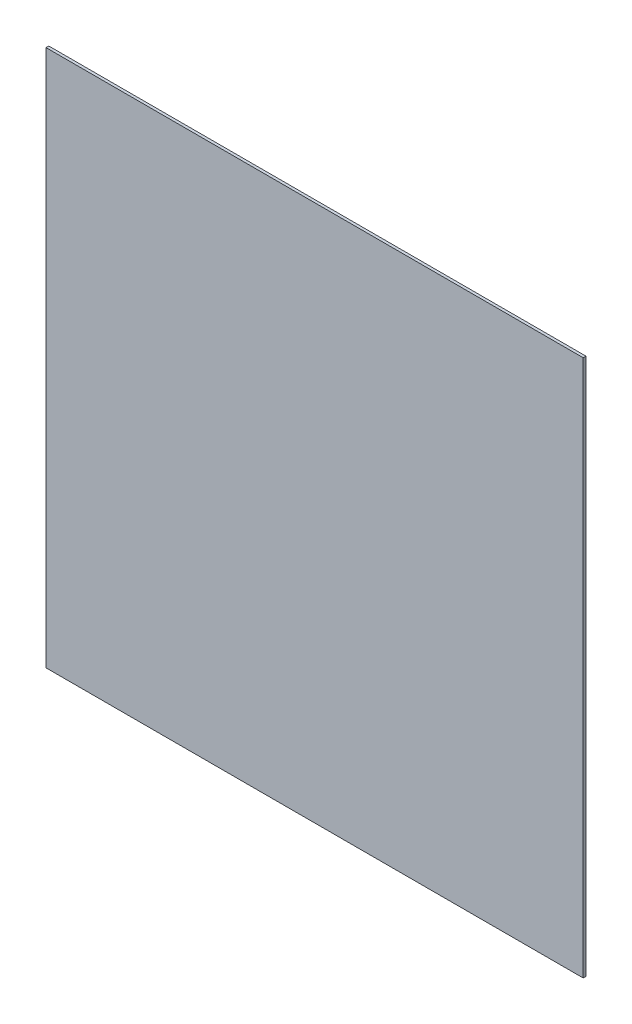
from build123d import *

# Parameters (mm, degrees)
SKETCH1_W           = 615.95
SKETCH1_H           = 615.95
BOSS_EXTRUDE1_DEPTH = 3.175


with BuildPart() as part:
    # Sketch1 → Boss-Extrude1 (new body)
    with BuildSketch(Plane.XY):
        Rectangle(SKETCH1_W, SKETCH1_H)
    extrude(amount=BOSS_EXTRUDE1_DEPTH)


solid = part.part
